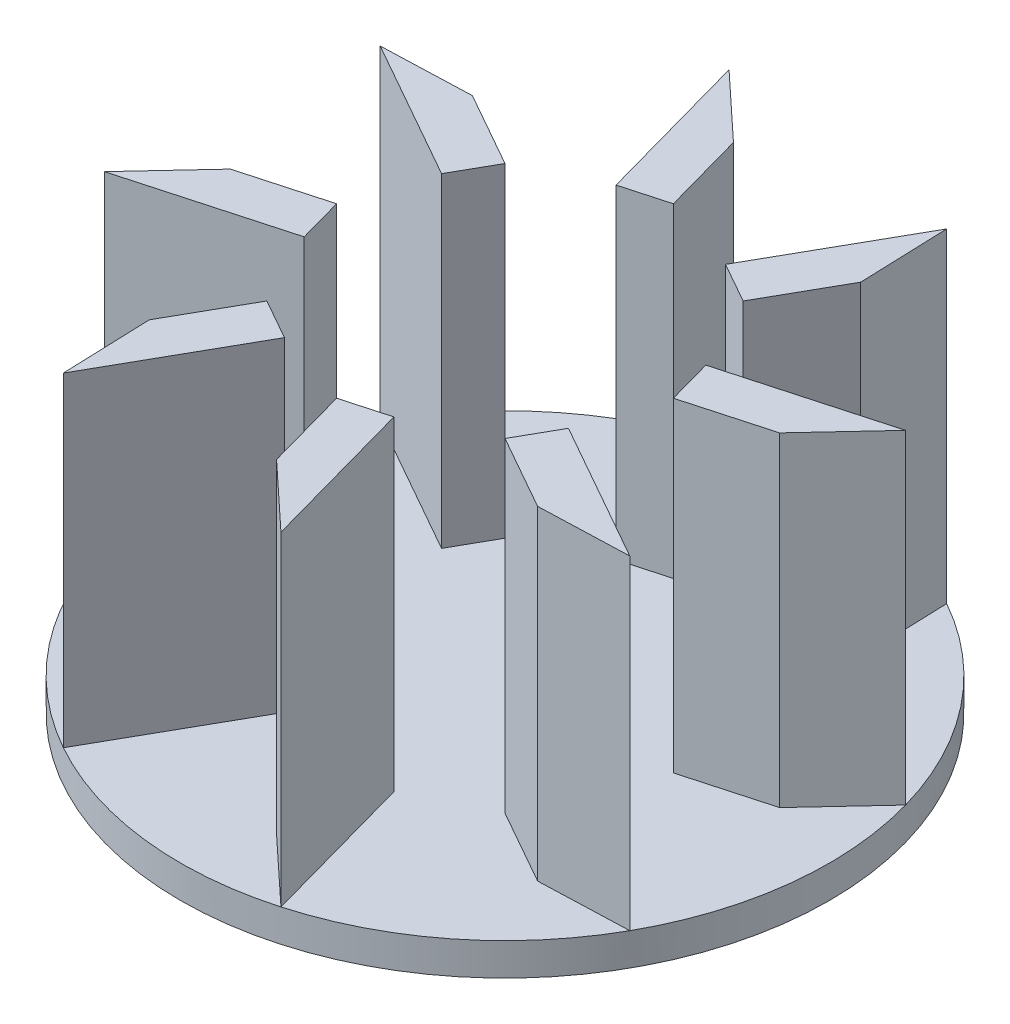
from build123d import *

# Parameters (mm, degrees)
SKETCH_1_R      = 20
EXTRUDE_1_DEPTH = 2
EXTRUDE_2_DEPTH = 20


with BuildPart() as part:
    # 草图1 → 凸台-拉伸1 (new body)
    with BuildSketch(Plane(origin=(0, 0, 0), x_dir=(1, 0, 0), z_dir=(0, 1, 0))):
        with Locations(Location((0, 0, 0), (0, 0, 270))):
            Circle(SKETCH_1_R)
    extrude(amount=EXTRUDE_1_DEPTH)

    # 草图2 → 凸台-拉伸2 (add)
    with BuildSketch(Plane(origin=(0, 2, 0), x_dir=(1, 0, 0), z_dir=(0, 1, 0))):
        Polygon((1.422012769, -15.50129709), (0, -10.377789627), (2.764347063, -9.610554125), (5.438718845, -19.246307109), align=None)
        Polygon((-9.955557418, -11.966587161), (-7.338205419, -7.338205419), (-4.840999439, -8.750376546), (-9.763439294, -17.454949245), align=None)
        Polygon((-15.50129709, -1.422012769), (-10.377789627, 0), (-9.610554125, -2.764347063), (-19.246307109, -5.438718845), align=None)
        Polygon((-11.966587161, 9.955557418), (-7.338205419, 7.338205419), (-8.750376546, 4.840999439), (-17.454949245, 9.763439294), align=None)
        Polygon((-1.422012769, 15.50129709), (0, 10.377789627), (-2.764347063, 9.610554125), (-5.438718845, 19.246307109), align=None)
        Polygon((9.955557418, 11.966587161), (7.338205419, 7.338205419), (4.840999439, 8.750376546), (9.763439294, 17.454949245), align=None)
        Polygon((15.50129709, 1.422012769), (10.377789627, 0), (9.610554125, 2.764347063), (19.246307109, 5.438718845), align=None)
        Polygon((11.966587161, -9.955557418), (7.338205419, -7.338205419), (8.750376546, -4.840999439), (17.454949245, -9.763439294), align=None)
    extrude(amount=EXTRUDE_2_DEPTH)


solid = part.part
